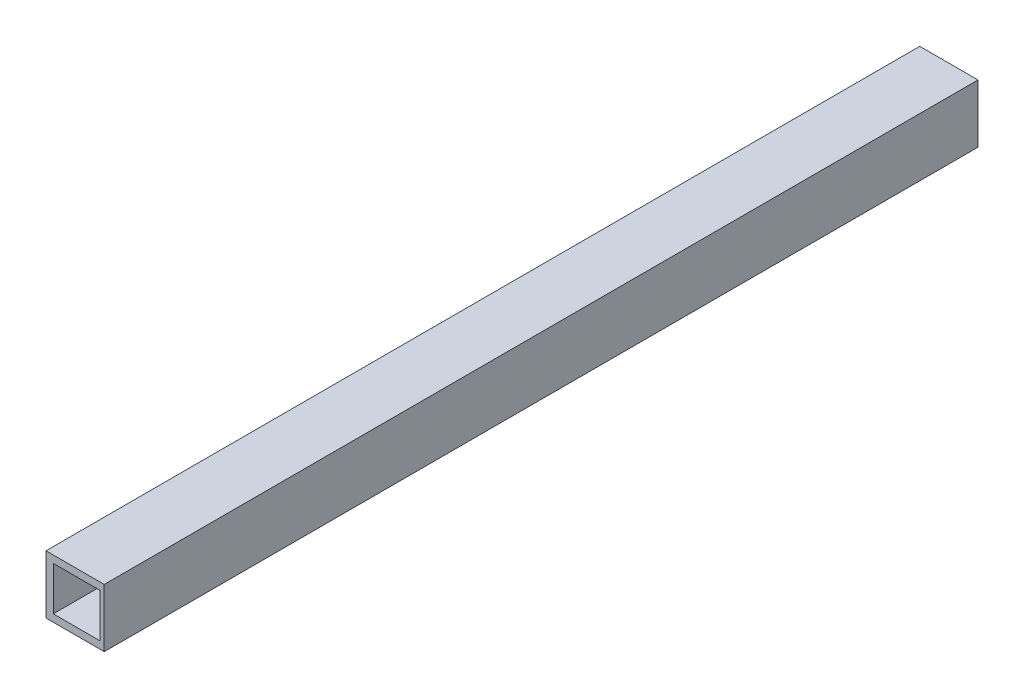
from build123d import *

# Parameters (mm, degrees)
SKETCH1_W           = 25.4
SKETCH1_H           = 25.4
BOSS_EXTRUDE2_DEPTH = 381
SKETCH2_W           = 20.302766191
SKETCH2_H           = 19.05
CUT_EXTRUDE1_DEPTH  = 383.689587002


with BuildPart() as part:
    # Sketch1 → Boss-Extrude2 (new body)
    with BuildSketch(Plane.XY):
        with Locations((12.7, 12.7)):
            Rectangle(SKETCH1_W, SKETCH1_H)
    extrude(amount=BOSS_EXTRUDE2_DEPTH)

    # Sketch2 → Cut-Extrude1 (cut, through all)
    with BuildSketch(Plane(origin=(0, 0, 0), x_dir=(-1, 0, 0), z_dir=(0, 0, -1))):
        with Locations((-13.326383096, 12.7)):
            Rectangle(SKETCH2_W, SKETCH2_H)
    extrude(amount=-CUT_EXTRUDE1_DEPTH, mode=Mode.SUBTRACT)


solid = part.part
